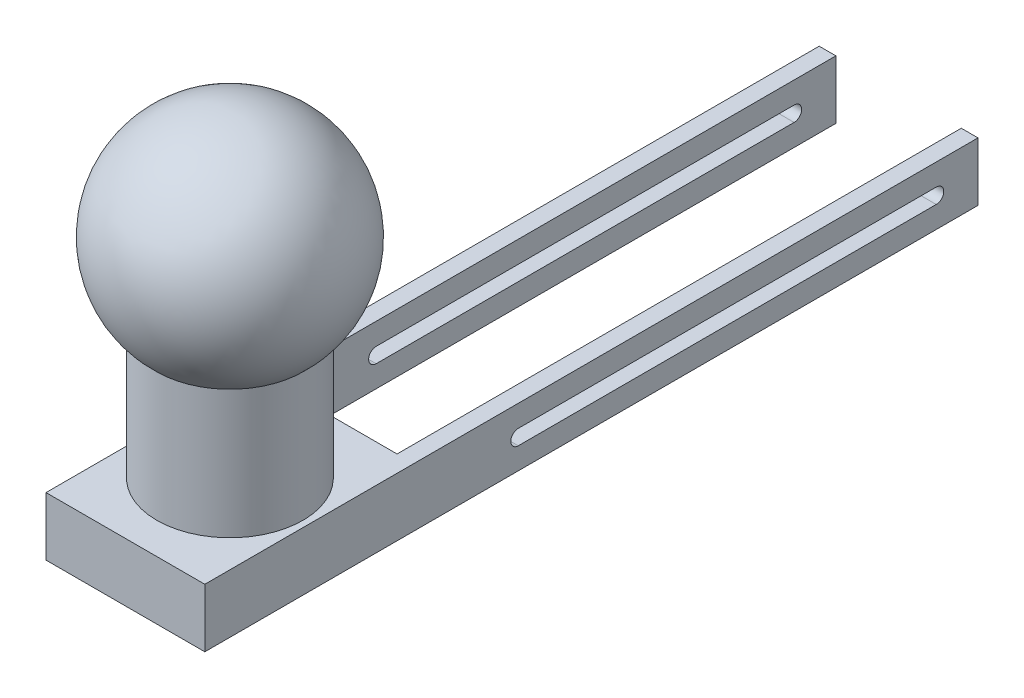
from build123d import *

# Parameters (mm, degrees)
BOSS_EXTRUDE1_DEPTH = 17.78
SKETCH3_R           = 22.225
BOSS_EXTRUDE2_DEPTH = 63.5
CUT_EXTRUDE1_DEPTH  = 167.711714849


with BuildPart() as part:
    # Sketch1 → Boss-Extrude1 (new body)
    with BuildSketch(Plane(origin=(0, 0, 0), x_dir=(1, 0, 0), z_dir=(0, 1, 0))):
        Polygon((-19.05, 112.888888889), (-24.13, 112.888888889), (-24.13, -122.061111111), (24.13, -122.061111111), (24.13, 112.888888889), (19.05, 112.888888889), (19.05, -58.561111111), (-19.05, -58.561111111), align=None)
    extrude(amount=-BOSS_EXTRUDE1_DEPTH)

    # Sketch3 → Boss-Extrude2 (add)
    with BuildSketch(Plane(origin=(0, 0, 0), x_dir=(1, 0, 0), z_dir=(0, 1, 0))):
        with Locations((0, -90.311111111)):
            Circle(SKETCH3_R)
    extrude(amount=BOSS_EXTRUDE2_DEPTH)

    # Sketch5 → Revolve1 (revolve)
    with BuildSketch(Plane(origin=(0, 0, 90.311111111), x_dir=(0, -1, 0), z_dir=(0, 0, 1))):
        with BuildLine():
            Line((-63.5, -33.02), (-63.5, 33.02))
            ThreePointArc((-63.5, 33.02), (-96.52, 0), (-63.5, -33.02))
        make_face()
    revolve(axis=Axis((0, 63.5, 90.311111111), (1, 0, 0)))

    # Sketch6 → Cut-Extrude1 (cut, through all)
    with BuildSketch(Plane.ZY.offset(24.13)):
        with BuildLine():
            Line((-100.188888889, -6.604), (26.811111111, -6.604))
            ThreePointArc((26.811111111, -6.604), (29.097111111, -8.89), (26.811111111, -11.176))
            Line((26.811111111, -11.176), (-100.188888889, -11.176))
            ThreePointArc((-100.188888889, -11.176), (-102.474888889, -8.89), (-100.188888889, -6.604))
        make_face()
    extrude(amount=-CUT_EXTRUDE1_DEPTH, mode=Mode.SUBTRACT)


solid = part.part
